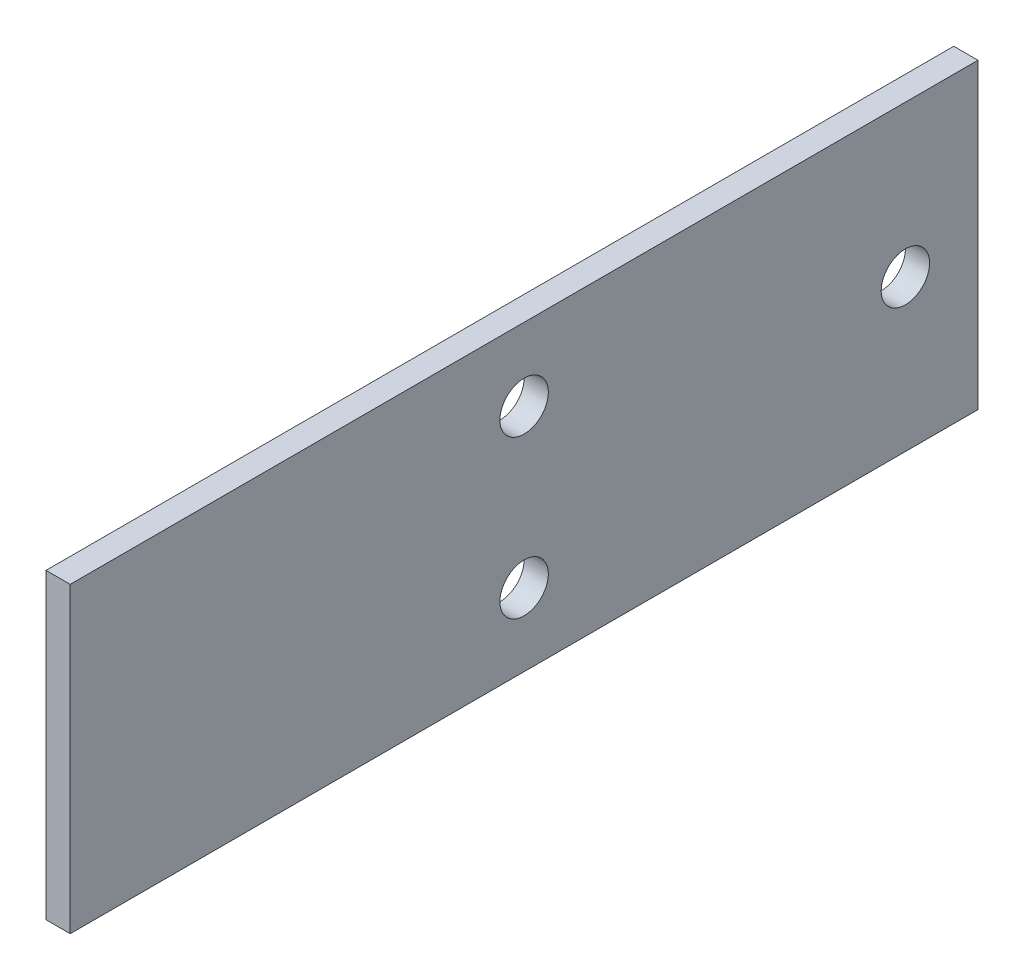
from build123d import *

# Parameters (mm, degrees)
SKETCH1_W           = 4
SKETCH1_H           = 150
BOSS_EXTRUDE1_DEPTH = 50
SKETCH2_R           = 4
CUT_EXTRUDE1_DEPTH  = 10


with BuildPart() as part:
    # Sketch1 → Boss-Extrude1 (new body)
    with BuildSketch(Plane(origin=(0, 0, 0), x_dir=(1, 0, 0), z_dir=(0, 1, 0))):
        Rectangle(SKETCH1_W, SKETCH1_H)
    extrude(amount=BOSS_EXTRUDE1_DEPTH)

    # Sketch2 → Cut-Extrude1 (cut)
    with BuildSketch(Plane.ZY.offset(2)):
        with Locations((0, 38)):
            Circle(SKETCH2_R)
        with Locations((0, 12)):
            Circle(SKETCH2_R)
        with Locations((-63, 25)):
            Circle(SKETCH2_R)
    extrude(amount=-CUT_EXTRUDE1_DEPTH, mode=Mode.SUBTRACT)


solid = part.part
